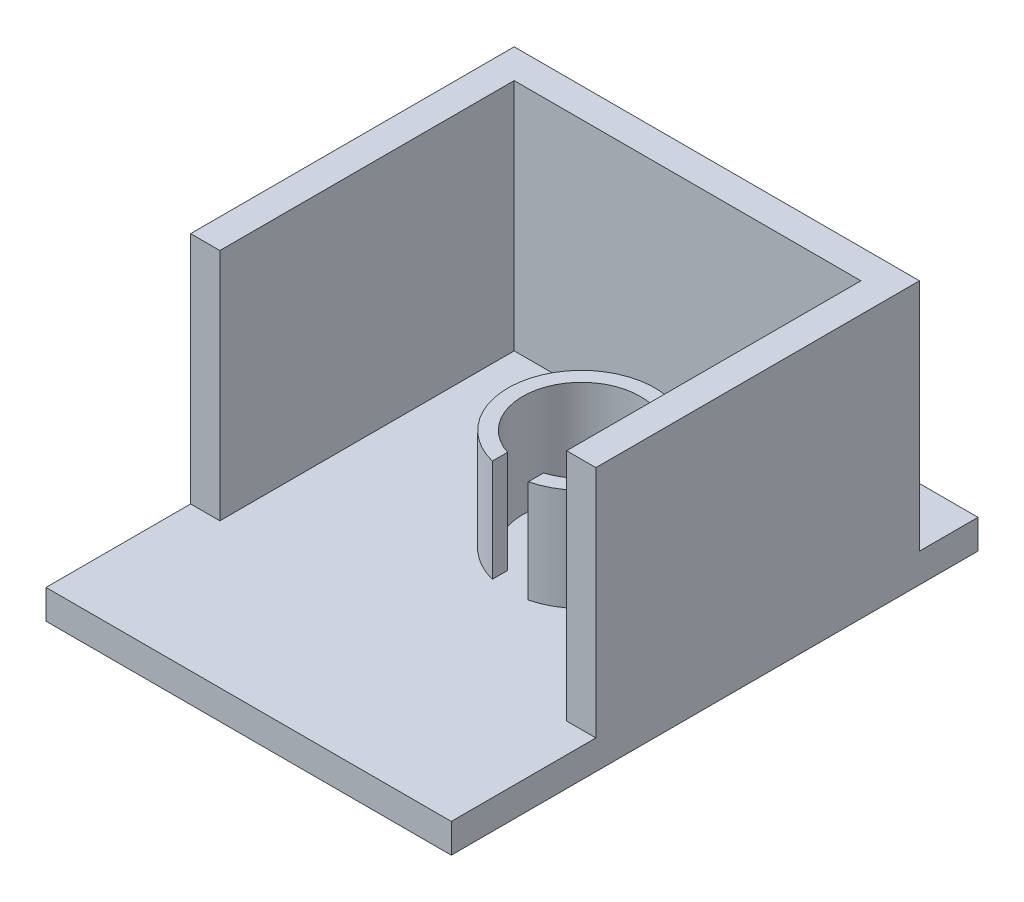
from build123d import *

# Parameters (mm, degrees)
SKETCH1_W            = 160
SKETCH1_H            = 160
BOSS_EXTRUDE1_DEPTH  = 5
BOSS_EXTRUDE8_DEPTH  = 35
BOSS_EXTRUDE11_DEPTH = 80
SKETCH23_W           = 160
SKETCH23_H           = 10
BOSS_EXTRUDE12_DEPTH = 20
SKETCH25_W           = 21.5
SKETCH25_H           = 180
CUT_EXTRUDE4_DEPTH   = 10


with BuildPart() as part:
    # Sketch1 → Boss-Extrude1 (new, symmetric)
    with BuildSketch(Plane(origin=(0, 0, 0), x_dir=(1, 0, 0), z_dir=(0, 1, 0))):
        Rectangle(SKETCH1_W, SKETCH1_H)
    extrude(amount=BOSS_EXTRUDE1_DEPTH, both=True)

    # Sketch17 → Boss-Extrude8 (add)
    with BuildSketch(Plane(origin=(0, 5, 0), x_dir=(1, 0, 0), z_dir=(0, 1, 0))):
        with BuildLine():
            Line((-6.135166846, 3.859212979), (-6.135166846, -1.338646794))
            ThreePointArc((-6.135166846, -1.338646794), (0, 48.1), (6.135166846, -1.338646794))
            Line((6.135166846, -1.338646794), (6.135166846, 3.859212979))
            ThreePointArc((6.135166846, 3.859212979), (0, 43.1), (-6.135166846, 3.859212979))
        make_face()
    extrude(amount=BOSS_EXTRUDE8_DEPTH)

    # Sketch19 → Boss-Extrude11 (add)
    with BuildSketch(Plane(origin=(0, 5, 0), x_dir=(1, 0, 0), z_dir=(0, 1, 0))):
        Polygon((-80, 80), (-80, -30.581038256), (-70, -30.581038256), (-70, 70), (48.5, 70), (48.5, 25.826966248), (48.5, -30.581038256), (58.5, -30.581038256), (58.5, 25.826966248), (58.5, 74), (58.5, 80), (-70, 80), align=None)
    extrude(amount=BOSS_EXTRUDE11_DEPTH)

    # Sketch23 → Boss-Extrude12 (add)
    with BuildSketch(Plane(origin=(0, 0, -80), x_dir=(-1, 0, 0), z_dir=(0, 0, -1))):
        Rectangle(SKETCH23_W, SKETCH23_H)
    extrude(amount=BOSS_EXTRUDE12_DEPTH)

    # Sketch25 → Cut-Extrude4 (cut)
    with BuildSketch(Plane(origin=(0, 5, 0), x_dir=(1, 0, 0), z_dir=(0, 1, 0))):
        with Locations((69.25, 10)):
            Rectangle(SKETCH25_W, SKETCH25_H)
    extrude(amount=-CUT_EXTRUDE4_DEPTH, mode=Mode.SUBTRACT)


solid = part.part
